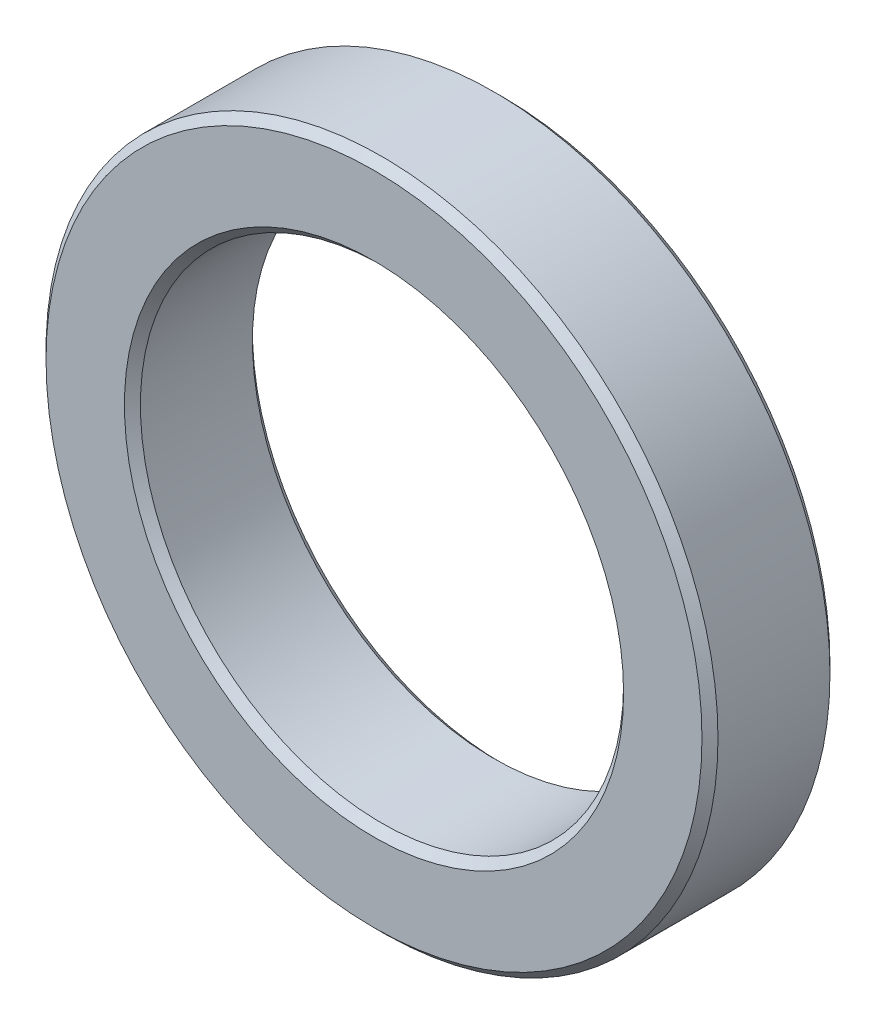
from build123d import *

# Parameters (mm, degrees)
SKETCH_1_R      = 21
SKETCH_1_R_2    = 15.1
EXTRUDE_1_DEPTH = 4
CHAMFER_1_SIZE  = 0.5


with BuildPart() as part:
    # 草图1 → 凸台-拉伸1 (new, symmetric)
    with BuildSketch(Plane.XY):
        Circle(SKETCH_1_R)
        Circle(SKETCH_1_R_2, mode=Mode.SUBTRACT)
    extrude(amount=EXTRUDE_1_DEPTH, both=True)

    # 倒角1
    chamfer_1_edges = [part.edges().sort_by_distance(p)[0] for p in [
        (-21, 0, -4),
        (-21, 0, 4),
        (-15.1, 0, -4),
        (-15.1, 0, 4),
    ]]
    chamfer(chamfer_1_edges, length=CHAMFER_1_SIZE)


solid = part.part
